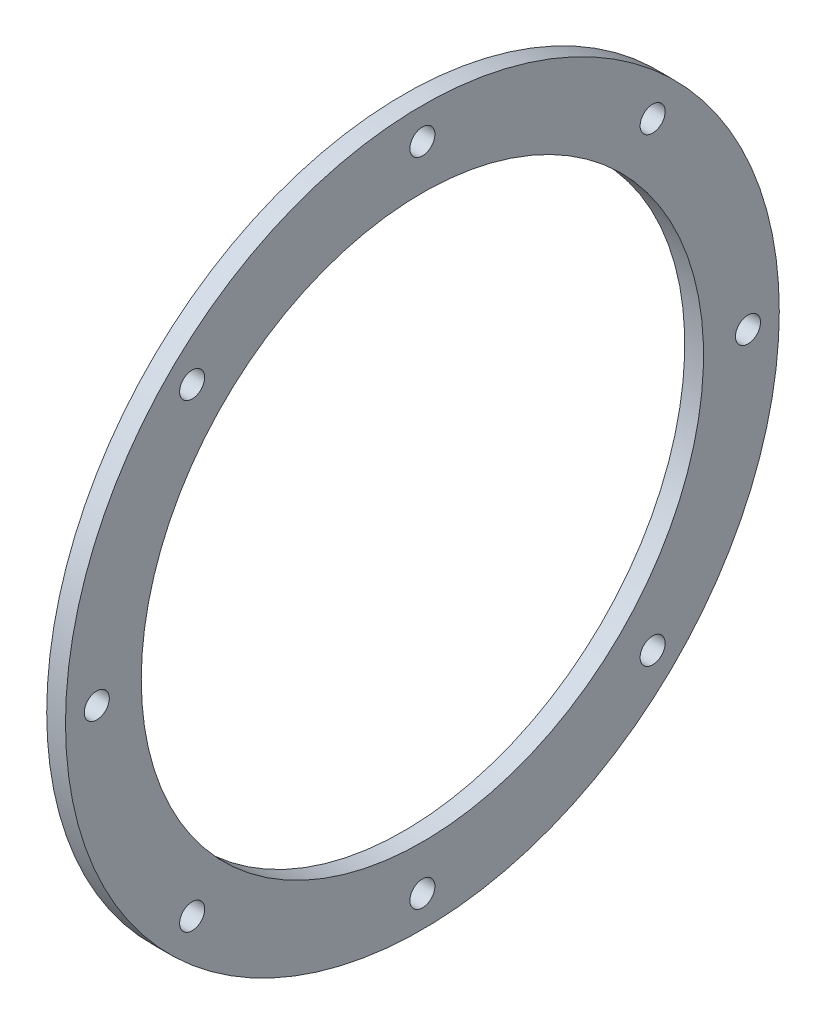
from build123d import *

# Parameters (mm, degrees)
SKETCH2_W          = 3
SKETCH2_H          = 12.1
SKETCH3_R          = 2
CUT_EXTRUDE1_DEPTH = 10
CIRPATTERN1_COUNT  = 8


with BuildPart() as part:
    # Sketch2 → Revolve1 (revolve)
    with BuildSketch(Plane.XY, mode=Mode.PRIVATE) as revolve1_sk:
        with Locations((10.74983843, 50.95)):
            Rectangle(SKETCH2_W, SKETCH2_H)
    revolve(revolve1_sk.sketch.rotate(Axis((-478.111946857, 0, 0), (1, 0, 0)), 90), axis=Axis((-478.111946857, 0, 0), (1, 0, 0)))

    # Sketch3 → Cut-Extrude1 (cut)
    with BuildSketch(Plane.ZY.offset(-9.24983843)):
        with Locations((0, 52)):
            Circle(SKETCH3_R)
    cut_extrude1 = extrude(amount=-CUT_EXTRUDE1_DEPTH, mode=Mode.SUBTRACT)

    # CirPattern1: Cut-Extrude1 ×8 about axis
    cirpattern1_axis = Axis((0, 0, 0), (1, 0, 0))
    for i in range(1, CIRPATTERN1_COUNT):
        add(cut_extrude1.rotate(cirpattern1_axis, i * 360 / CIRPATTERN1_COUNT), mode=Mode.SUBTRACT)


solid = part.part
